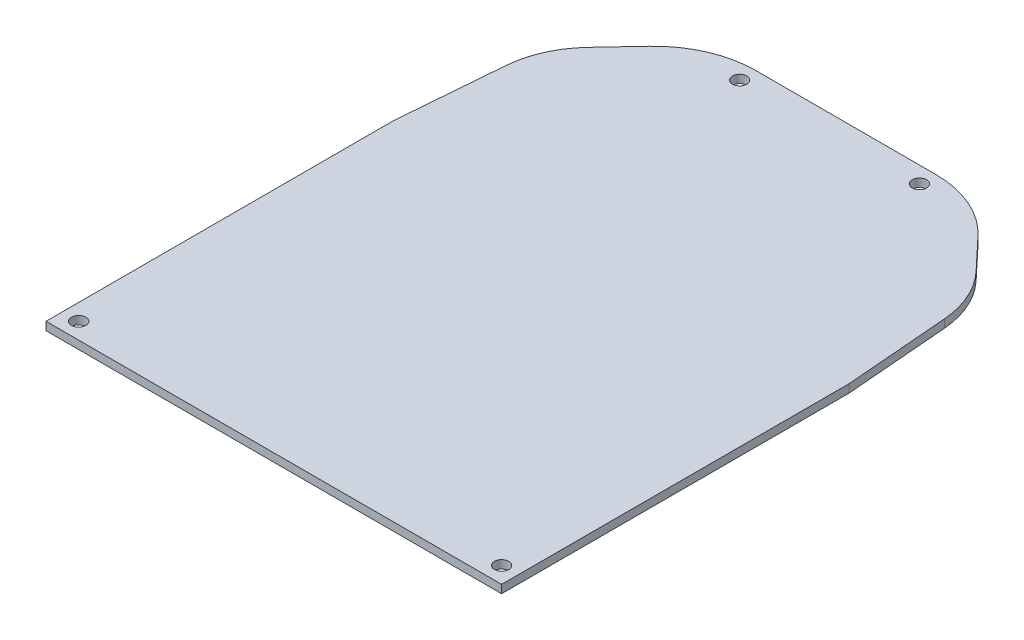
from build123d import *

# Parameters (mm, degrees)
ESQUISSE1_R        = 1.75
BOSS_EXTRU_1_DEPTH = 2


with BuildPart() as part:
    # Esquisse1 → Boss.-Extru.1 (new body)
    with BuildSketch(Plane(origin=(0, 0, 0), x_dir=(1, 0, 0), z_dir=(0, 1, 0))):
        with BuildLine():
            Line((55.75, -70), (55.75, 15))
            Line((55.75, 15), (53.674026321, 40.47775659))
            ThreePointArc((53.674026321, 40.47775659), (51.771291303, 47.94288813), (47.510174455, 54.360946457))
            Line((47.510174455, 54.360946457), (40.217580929, 62.120740202))
            ThreePointArc((40.217580929, 62.120740202), (31.924250474, 67.945789429), (22, 70))
            Line((22, 70), (-22, 70))
            ThreePointArc((-22, 70), (-31.924250474, 67.945789429), (-40.217580929, 62.120740202))
            Line((-40.217580929, 62.120740202), (-47.510174455, 54.360946457))
            ThreePointArc((-47.510174455, 54.360946457), (-51.771291303, 47.94288813), (-53.674026321, 40.47775659))
            Line((-53.674026321, 40.47775659), (-55.75, 15))
            Line((-55.75, 15), (-55.75, -70))
            Line((-55.75, -70), (55.75, -70))
        make_face()
        with Locations(Location((-51.75, -66, 0), (0, 0, 270))):
            Circle(ESQUISSE1_R, mode=Mode.SUBTRACT)
        with Locations(Location((51.75, -66, 0), (0, 0, 270))):
            Circle(ESQUISSE1_R, mode=Mode.SUBTRACT)
        with Locations(Location((22, 66, 0), (0, 0, 270))):
            Circle(ESQUISSE1_R, mode=Mode.SUBTRACT)
        with Locations(Location((-22, 66, 0), (0, 0, 270))):
            Circle(ESQUISSE1_R, mode=Mode.SUBTRACT)
    extrude(amount=BOSS_EXTRU_1_DEPTH)


solid = part.part
